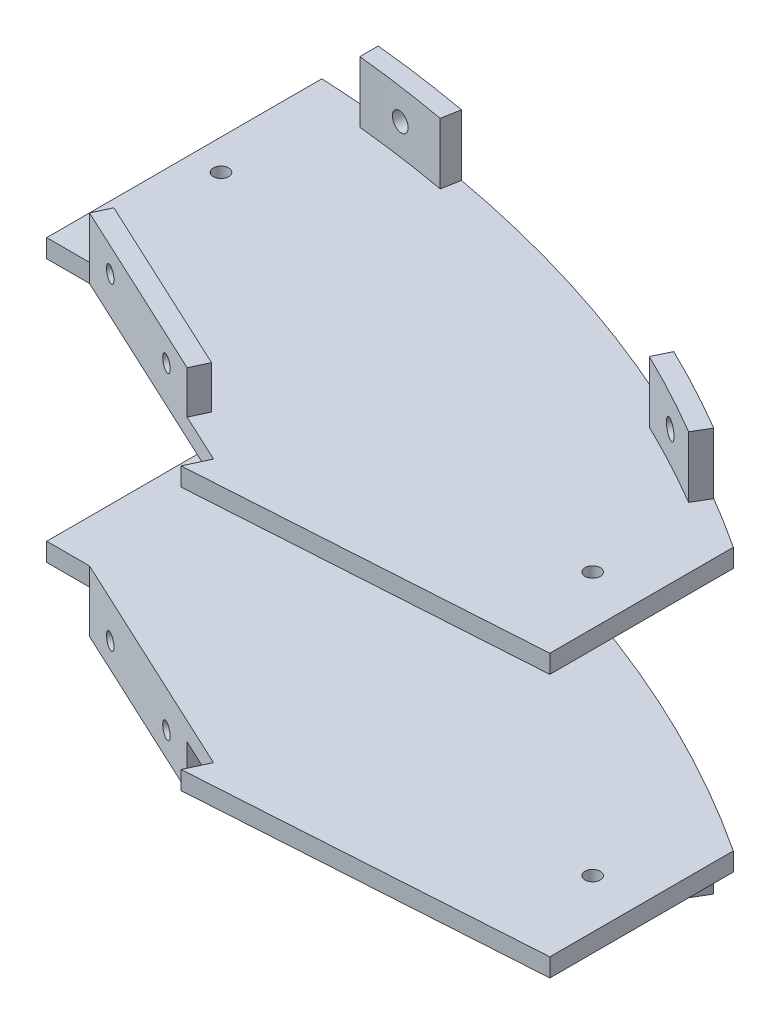
from build123d import *

# Parameters (mm, degrees)
BOSS_EXTRUDE1_DEPTH     = 3
SKETCH2_W               = 33
SKETCH2_H               = 10
SKETCH2_R               = 1.25
BOSS_EXTRUDE2_DEPTH     = 3
SKETCH3_R               = 1.25
CUT_EXTRUDE1_DEPTH      = 111.114926801
BOSS_EXTRUDE3_DEPTH     = 10
CUT_EXTRUDE2_REACH      = 107.286
CUT_EXTRUDE2_END_RADIUS = 197.003812576
SKETCH8_R               = 1.5
CUT_EXTRUDE3_REACH      = 97.662
CUT_EXTRUDE3_END_RADIUS = 197.003812576
SKETCH9_R               = 1.5


with BuildPart() as part:
    # Sketch1 → Boss-Extrude1 (new body)
    with BuildSketch(Plane(origin=(0, 0, 0), x_dir=(1, 0, 0), z_dir=(0, 1, 0))):
        with BuildLine():
            Line((0, 45), (0, 0))
            Line((0, 0), (7, 0))
            Line((7, 0), (45.00148551, -17.720383715))
            Line((45.00148551, -17.720383715), (43.311012463, -21.345614863))
            Line((43.311012463, -21.345614863), (100.00148551, -17.720383715))
            Line((100.00148551, -17.720383715), (100.00148551, 12.279616285))
            ThreePointArc((100.00148551, 12.279616285), (52.191052923, 35.333931061), (0, 45))
        make_face()
    extrude(amount=BOSS_EXTRUDE1_DEPTH)

    # Sketch2 → Boss-Extrude2 (add)
    with BuildSketch(Plane(origin=(1.250243366, 0, -2.681155551), x_dir=(0.9063077870366495, 0, 0.42261826174070033), z_dir=(-0.42261826174070033, 0, 0.9063077870366495))):
        with Locations((22.844154509, 5)):
            Rectangle(SKETCH2_W, SKETCH2_H)
        with Locations((13.344154509, 6)):
            Circle(SKETCH2_R, mode=Mode.SUBTRACT)
        with Locations((32.344154509, 6)):
            Circle(SKETCH2_R, mode=Mode.SUBTRACT)
    extrude(amount=-BOSS_EXTRUDE2_DEPTH)

    # Sketch3 → Cut-Extrude1 (cut, through all)
    with BuildSketch(Plane.XZ):
        with Locations(Location((5, -23.5, 0), (0, 0, 270))):
            Circle(SKETCH3_R)
        with Locations(Location((92.00148551, 2.720383715, 0), (0, 0, 270))):
            Circle(SKETCH3_R)
    extrude(amount=-CUT_EXTRUDE1_DEPTH, mode=Mode.SUBTRACT)

    # Sketch6 → Boss-Extrude3 (add)
    with BuildSketch(Plane(origin=(0, 3, 0), x_dir=(1, 0, 0), z_dir=(0, 1, 0))):
        with BuildLine():
            ThreePointArc((25.815183319, 42.016667614), (17.915864182, 43.291962745), (9.971855225, 44.250264466))
            Line((9.971855225, 44.250264466), (9.971855225, 41.238788581))
            ThreePointArc((9.971855225, 41.238788581), (17.646509134, 40.304062324), (25.278576941, 39.068923955))
            Line((25.278576941, 39.068923955), (25.815183319, 42.016667614))
        make_face()
        with BuildLine():
            ThreePointArc((91.515126037, 17.56938971), (84.541117021, 21.492248202), (77.415775106, 25.13300679))
            Line((77.415775106, 25.13300679), (76.106143507, 22.438196193))
            ThreePointArc((76.106143507, 22.438196193), (83.124741123, 18.85197958), (89.994272948, 14.987889185))
            Line((89.994272948, 14.987889185), (91.515126037, 17.56938971))
        make_face()
    extrude(amount=BOSS_EXTRUDE3_DEPTH)

    # Cut-Extrude2: up to this cylinder (the profile starts outside it)
    cut_extrude2_end = Plane(origin=(-10.004096478, 8, 154.749638432), z_dir=(0, -1, 0)) * Cylinder(CUT_EXTRUDE2_END_RADIUS, 609.579625152, mode=Mode.PRIVATE)
    # Sketch8 → Cut-Extrude2 (cut, up to the surface)
    with BuildSketch(Plane(origin=(17.915864182, 13, -43.291962745), x_dir=(-0.9902080058846243, 0, -0.1395998033021389), z_dir=(0.1395998033021389, 0, -0.9902080058846243)), mode=Mode.PRIVATE) as cut_extrude2_sk1:
        with Locations((0, -5)):
            Circle(SKETCH8_R)
    cut_extrude2_tool1 = extrude(cut_extrude2_sk1.sketch, amount=-CUT_EXTRUDE2_REACH, mode=Mode.PRIVATE) - cut_extrude2_end
    add(cut_extrude2_tool1.solids().sort_by_distance((17.915864, 8, -43.291963))[0], mode=Mode.SUBTRACT)

    # Cut-Extrude3: up to this cylinder (the profile starts outside it)
    cut_extrude3_end = Plane(origin=(-10.004096478, 8, 154.749638432), z_dir=(0, -1, 0)) * Cylinder(CUT_EXTRUDE3_END_RADIUS, 590.331625152, mode=Mode.PRIVATE)
    # Sketch9 → Cut-Extrude3 (cut, up to the surface)
    with BuildSketch(Plane(origin=(84.541117021, 13, -21.492248202), x_dir=(-0.8812094331704029, 0, -0.47272606749733775), z_dir=(0.47272606749733775, 0, -0.8812094331704029)), mode=Mode.PRIVATE) as cut_extrude3_sk1:
        with Locations((0, -5)):
            Circle(SKETCH9_R)
    cut_extrude3_tool1 = extrude(cut_extrude3_sk1.sketch, amount=-CUT_EXTRUDE3_REACH, mode=Mode.PRIVATE) - cut_extrude3_end
    add(cut_extrude3_tool1.solids().sort_by_distance((84.541117, 8, -21.492248))[0], mode=Mode.SUBTRACT)


with BuildPart() as body_2:
    # Mirror1: mirrored copy
    add(part.part.mirror(Plane(origin=(0, -20, 0), x_dir=(0, 0, 1), z_dir=(0, -1, 0))))


solid = Compound([part.part, body_2.part])
